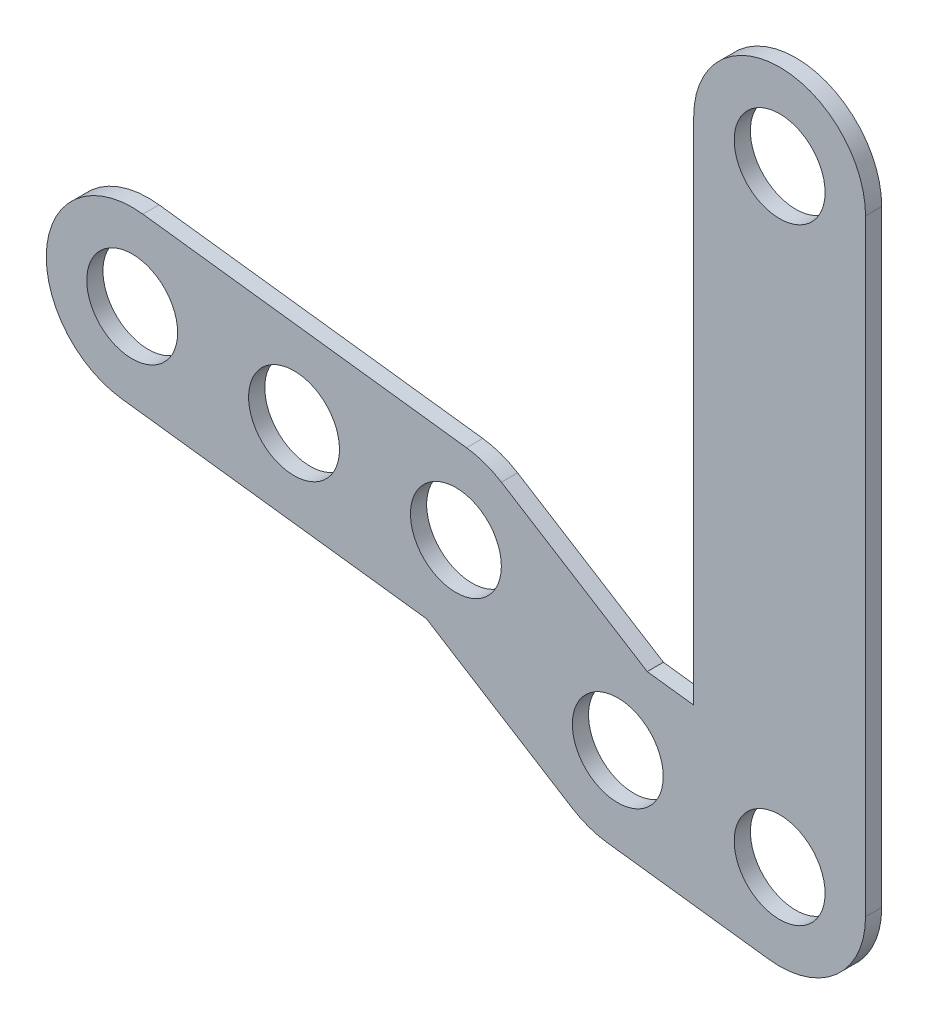
from build123d import *

# Parameters (mm, degrees)
MODEL_R             = 14.2621
BOSS_EXTRUDE1_DEPTH = 5.08


with BuildPart() as part:
    # Model → Boss-Extrude1 (new body)
    with BuildSketch(Plane.XY):
        with BuildLine():
            Line((293.6621, 222.25), (293.6621, 31.75))
            ThreePointArc((293.6621, 31.75), (284.54358689, 11.537102056), (263.355763082, 4.996104661))
            Line((263.355763082, 4.996104661), (212.555763082, 11.346104661))
            ThreePointArc((212.555763082, 11.346104661), (206.870950218, 12.694664017), (201.61011558, 15.236184928))
            Line((201.61011558, 15.236184928), (155.853864238, 43.833842015))
            Line((155.853864238, 43.833842015), (60.155763082, 55.796104661))
            ThreePointArc((60.155763082, 55.796104661), (36.746104661, 85.894236918), (66.844236918, 109.303895339))
            Line((66.844236918, 109.303895339), (168.444236918, 96.603895339))
            ThreePointArc((168.444236918, 96.603895339), (174.129049782, 95.255335983), (179.38988442, 92.713815072))
            Line((179.38988442, 92.713815072), (225.146135762, 64.116157985))
            Line((225.146135762, 64.116157985), (239.7379, 62.292187455))
            Line((239.7379, 62.292187455), (239.7379, 222.25))
            ThreePointArc((239.7379, 222.25), (266.7, 249.2121), (293.6621, 222.25))
        make_face()
        with Locations((63.5, 82.55)):
            Circle(MODEL_R, mode=Mode.SUBTRACT)
        with Locations((114.3, 76.2)):
            Circle(MODEL_R, mode=Mode.SUBTRACT)
        with Locations((165.1, 69.85)):
            Circle(MODEL_R, mode=Mode.SUBTRACT)
        with Locations((215.9, 38.1)):
            Circle(MODEL_R, mode=Mode.SUBTRACT)
        with Locations((266.7, 222.25)):
            Circle(MODEL_R, mode=Mode.SUBTRACT)
        with Locations((266.7, 31.75)):
            Circle(MODEL_R, mode=Mode.SUBTRACT)
    extrude(amount=BOSS_EXTRUDE1_DEPTH)


solid = part.part
